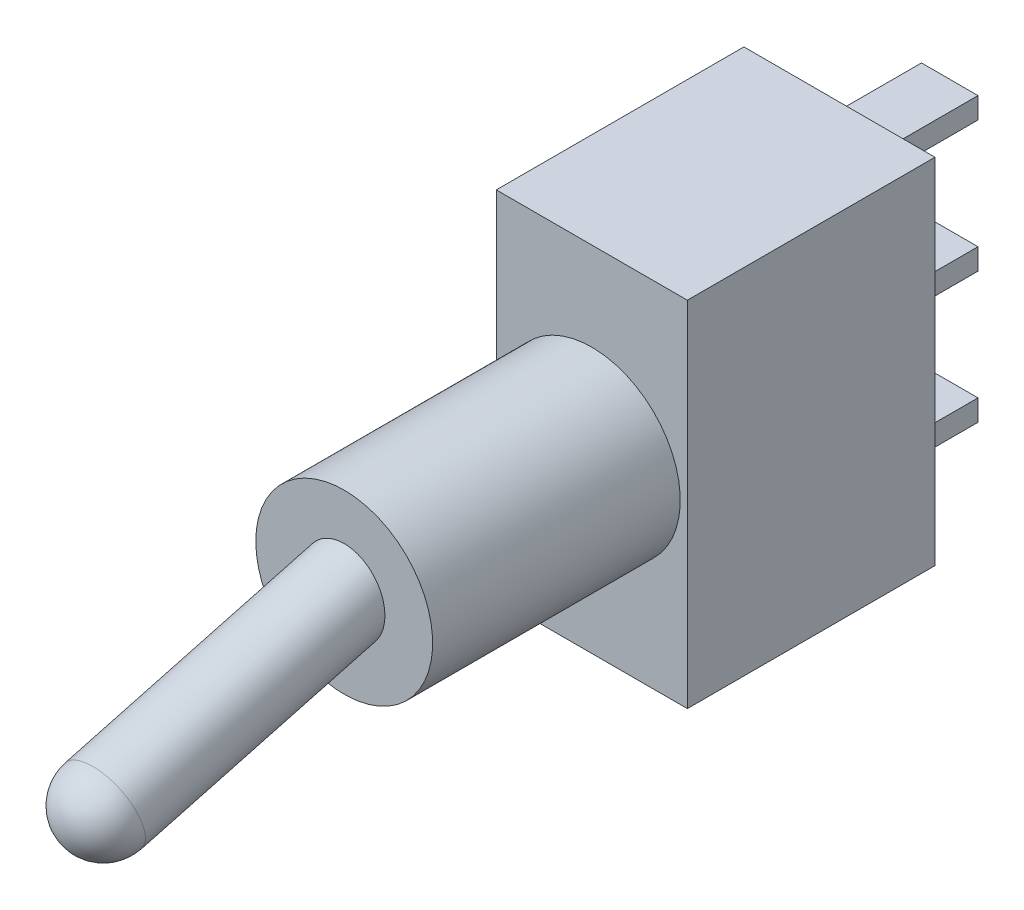
from build123d import *

# Parameters (mm, degrees)
ESQUISSE1_W        = 6.86
ESQUISSE1_H        = 12.7
BOSS_EXTRU_1_DEPTH = 8.89
ESQUISSE2_R        = 3.175
BOSS_EXTRU_2_DEPTH = 8.89
ESQUISSE4_W        = 2.03
ESQUISSE4_H        = 0.76
BOSS_EXTRU_3_DEPTH = 3.96


with BuildPart() as part:
    # Esquisse1 → Boss.-Extru.1 (new body)
    with BuildSketch(Plane.XY):
        Rectangle(ESQUISSE1_W, ESQUISSE1_H)
    extrude(amount=-BOSS_EXTRU_1_DEPTH)

    # Esquisse2 → Boss.-Extru.2 (add)
    with BuildSketch(Plane.XY):
        with Locations(Location((0, 0, 0), (0, 0, 180))):
            Circle(ESQUISSE2_R)
    extrude(amount=BOSS_EXTRU_2_DEPTH)

    # Esquisse3 → Révolution1 (revolve)
    with BuildSketch(Plane(origin=(0, 0, 0), x_dir=(0, 0, -1), z_dir=(1, 0, 0))):
        with BuildLine():
            Line((-17.912911951, -0.906178747), (-8.89, 1.511503223))
            Line((-8.89, 1.511503223), (-8.512124194, 0.101251517))
            Line((-8.512124194, 0.101251517), (-18.945287852, -2.69430626))
            ThreePointArc((-18.945287852, -2.69430626), (-18.799433235, -1.586430454), (-17.912911951, -0.906178747))
        make_face()
    revolve(axis=Axis((0, 0, 8.89), (0, -0.2588190451025216, 0.9659258262890681)))

    # Esquisse4 → Boss.-Extru.3 (add)
    with BuildSketch(Plane(origin=(0, 0, -8.89), x_dir=(-1, 0, 0), z_dir=(0, 0, -1))):
        Rectangle(ESQUISSE4_W, ESQUISSE4_H)
        with Locations((0, 4.7)):
            Rectangle(ESQUISSE4_W, ESQUISSE4_H)
        with Locations((0, -4.7)):
            Rectangle(ESQUISSE4_W, ESQUISSE4_H)
    extrude(amount=BOSS_EXTRU_3_DEPTH)


solid = part.part
